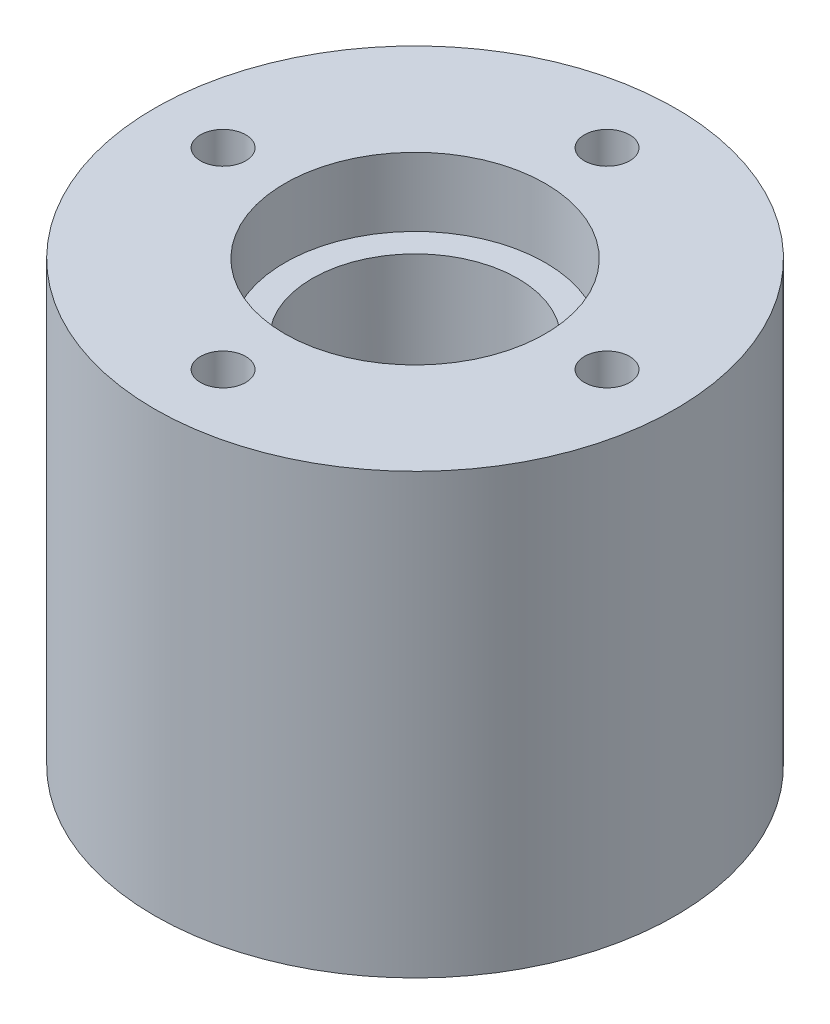
from build123d import *

# Parameters (mm, degrees)
SKETCH_1_R             = 19
SKETCH_1_R_2           = 7.5
EXTRUDE_1_DEPTH        = 32
SKETCH_2_R             = 9.5
CUT_EXTRUDE_1_DEPTH    = 5
CUT_EXTRUDE_START      = -5
SKETCH_3_R             = 9.5
CUT_EXTRUDE_2_DEPTH    = 5
HOLE_WIZARD_M4_1_D     = 3.3
HOLE_WIZARD_M4_1_DEPTH = 10.1
HOLE_WIZARD_M4_1_TIP   = 0.991420021
HOLE_WIZARD_M4_2_D     = 3.3
HOLE_WIZARD_M4_2_DEPTH = 10.1
HOLE_WIZARD_M4_2_TIP   = 0.991420021


with BuildPart() as part:
    # 草图1 → 凸台-拉伸1 (new body)
    with BuildSketch(Plane(origin=(0, 0, 0), x_dir=(1, 0, 0), z_dir=(0, 1, 0))):
        with Locations(Location((0, 0, 0), (0, 0, 270))):
            Circle(SKETCH_1_R)
        with Locations(Location((0, 0, 0), (0, 0, 270))):
            Circle(SKETCH_1_R_2, mode=Mode.SUBTRACT)
    extrude(amount=EXTRUDE_1_DEPTH)

    # 草图2 → 切除-拉伸1 (cut)
    with BuildSketch(Plane(origin=(0, 32, 0), x_dir=(1, 0, 0), z_dir=(0, 1, 0))):
        with Locations(Location((0, 0, 0), (0, 0, 270))):
            Circle(SKETCH_2_R)
    extrude(amount=-CUT_EXTRUDE_1_DEPTH, mode=Mode.SUBTRACT)

    # 草图3 → 切除-拉伸2 (cut)
    with BuildSketch(Plane.XZ.offset(CUT_EXTRUDE_START)):
        with Locations(Location((0, 0, 0), (0, 0, 90))):
            Circle(SKETCH_3_R)
    extrude(amount=CUT_EXTRUDE_2_DEPTH, mode=Mode.SUBTRACT)

    # M4 螺纹孔1
    with Locations(Plane.XZ):
        with Locations((0, -14), (-14, 0), (0, 14), (14, 0)):
            Hole(HOLE_WIZARD_M4_1_D / 2, depth=HOLE_WIZARD_M4_1_DEPTH)
            with Locations((0, 0, -(HOLE_WIZARD_M4_1_DEPTH + HOLE_WIZARD_M4_1_TIP / 2))):  # 118° drill point
                Cone(0, HOLE_WIZARD_M4_1_D / 2, HOLE_WIZARD_M4_1_TIP, mode=Mode.SUBTRACT)

    # M4 螺纹孔2
    with Locations(Plane(origin=(0, 32, 0), x_dir=(-1, 0, 0), z_dir=(0, 1, 0))):
        with Locations((-14, 0), (0, 14), (14, 0), (0, -14)):
            Hole(HOLE_WIZARD_M4_2_D / 2, depth=HOLE_WIZARD_M4_2_DEPTH)
            with Locations((0, 0, -(HOLE_WIZARD_M4_2_DEPTH + HOLE_WIZARD_M4_2_TIP / 2))):  # 118° drill point
                Cone(0, HOLE_WIZARD_M4_2_D / 2, HOLE_WIZARD_M4_2_TIP, mode=Mode.SUBTRACT)


solid = part.part
